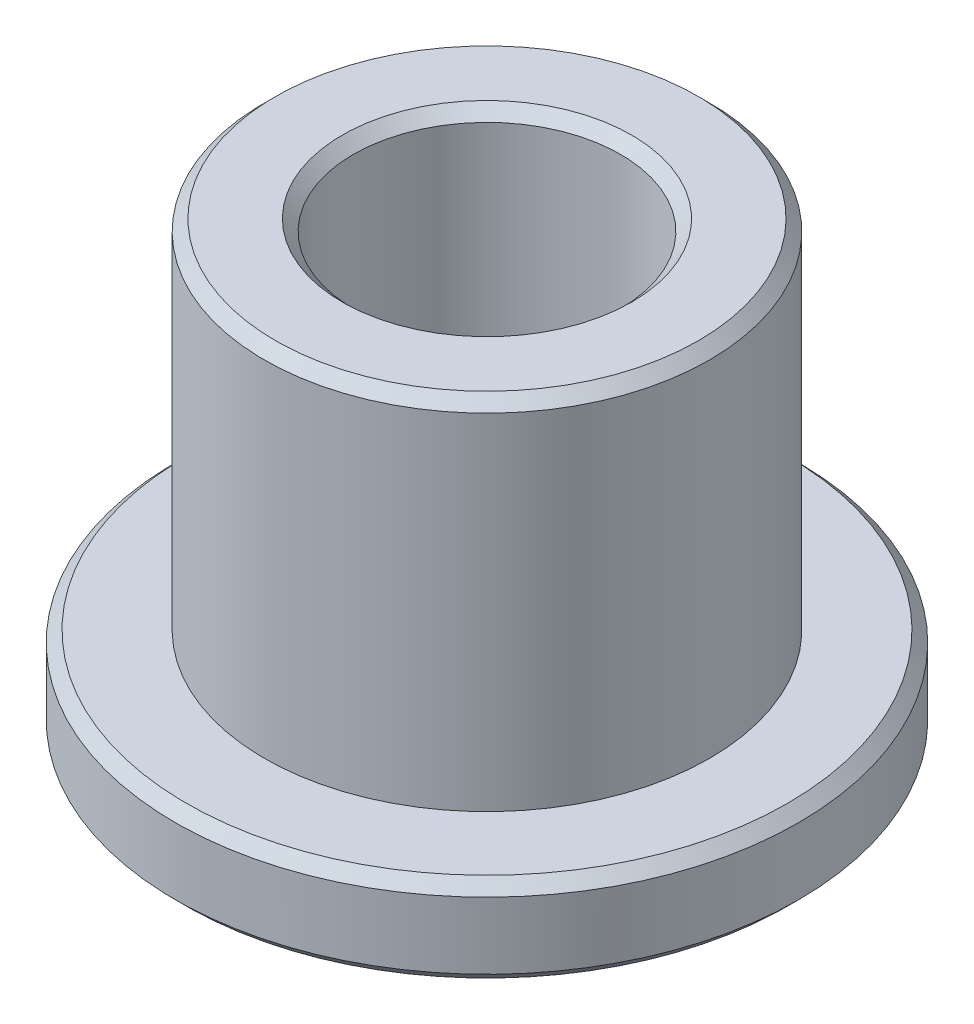
from build123d import *

# Parameters (mm, degrees)
CHAMFER1_SIZE = 0.25


with BuildPart() as part:
    # Sketch1 → Revolve1 (revolve)
    with BuildSketch(Plane.XY, mode=Mode.PRIVATE) as revolve1_sk:
        Polygon((-3, 0), (-3, 10), (-5, 10), (-5, 2), (-7, 2), (-7, 0), align=None)
    revolve(revolve1_sk.sketch.rotate(Axis((0, -356.558848917, 0), (0, 1, 0)), 180), axis=Axis((0, -356.558848917, 0), (0, 1, 0)))

    # Chamfer1
    chamfer1_edges = [part.edges().sort_by_distance(p)[0] for p in [
        (-7, 0, 0),
        (-7, 2, 0),
        (-5, 10, 0),
        (-3, 10, 0),
    ]]
    chamfer(chamfer1_edges, length=CHAMFER1_SIZE)


solid = part.part
